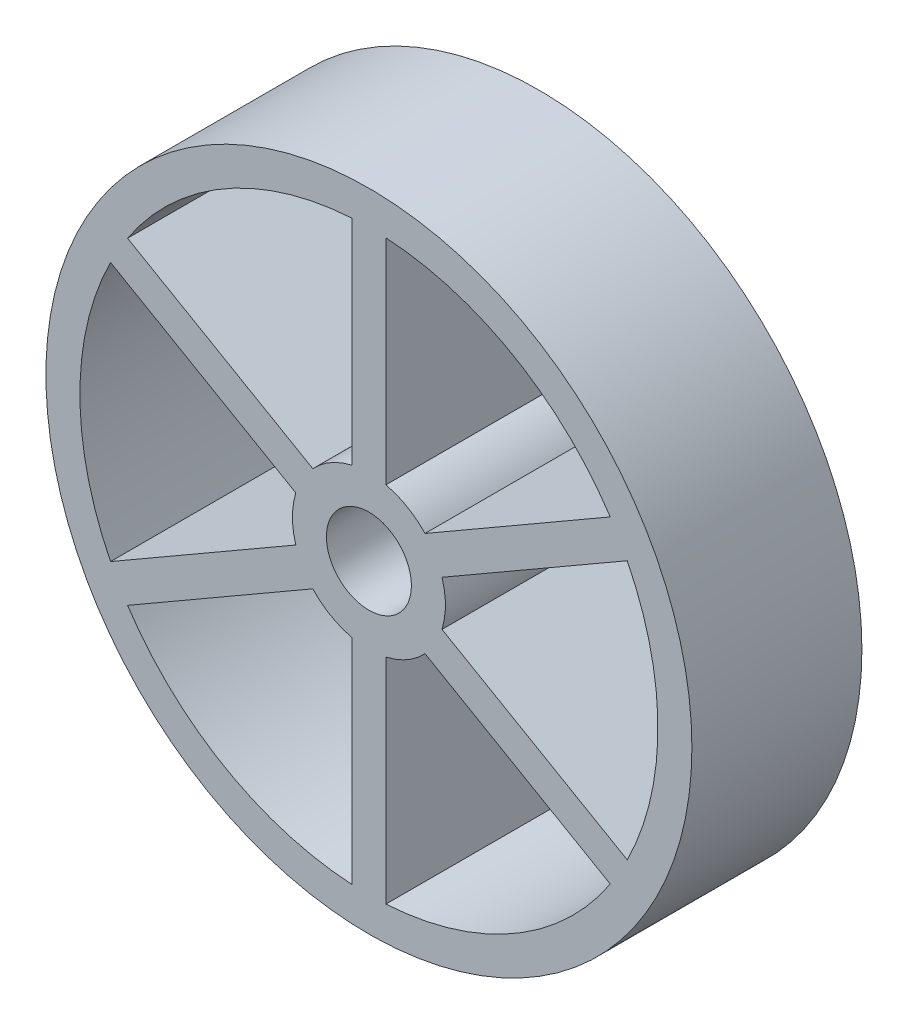
from build123d import *

# Parameters (mm, degrees)
SKETCH1_R           = 19
BOSS_EXTRUDE1_DEPTH = 10
SKETCH2_R           = 2.5
CUT_EXTRUDE1_DEPTH  = 10
CUT_EXTRUDE2_DEPTH  = 10


with BuildPart() as part:
    # Sketch1 → Boss-Extrude1 (new body)
    with BuildSketch(Plane.XY):
        Circle(SKETCH1_R)
    extrude(amount=BOSS_EXTRUDE1_DEPTH)

    # Sketch2 → Cut-Extrude1 (cut)
    with BuildSketch(Plane.XY.offset(10)):
        Circle(SKETCH2_R)
    extrude(amount=-CUT_EXTRUDE1_DEPTH, mode=Mode.SUBTRACT)

    # Sketch3 → Cut-Extrude2 (cut)
    with BuildSketch(Plane.XY.offset(10)):
        with BuildLine():
            ThreePointArc((-3.299671038, 3.059766501), (-2.25, 3.897114317), (-1, 4.387482194))
            Line((-1, 4.387482194), (-1, 16.970562748))
            ThreePointArc((-1, 16.970562748), (-8.5, 14.722431864), (-14.196938457, 9.351306778))
            Line((-14.196938457, 9.351306778), (-3.299671038, 3.059766501))
        make_face()
        with BuildLine():
            ThreePointArc((-4.299671038, -1.327715693), (-4.5, 0), (-4.299671038, 1.327715693))
            Line((-4.299671038, 1.327715693), (-15.196938457, 7.61925597))
            ThreePointArc((-15.196938457, 7.61925597), (-17, 0), (-15.196938457, -7.61925597))
            Line((-15.196938457, -7.61925597), (-4.299671038, -1.327715693))
        make_face()
        with BuildLine():
            ThreePointArc((-1, -4.387482194), (-2.25, -3.897114317), (-3.299671038, -3.059766501))
            Line((-3.299671038, -3.059766501), (-14.196938457, -9.351306778))
            ThreePointArc((-14.196938457, -9.351306778), (-8.5, -14.722431864), (-1, -16.970562748))
            Line((-1, -16.970562748), (-1, -4.387482194))
        make_face()
        with BuildLine():
            Line((14.196938457, -9.351306778), (3.299671038, -3.059766501))
            ThreePointArc((3.299671038, -3.059766501), (2.25, -3.897114317), (1, -4.387482194))
            Line((1, -4.387482194), (1, -16.970562748))
            ThreePointArc((1, -16.970562748), (8.5, -14.722431864), (14.196938457, -9.351306778))
        make_face()
        with BuildLine():
            Line((15.196938457, 7.61925597), (4.299671038, 1.327715693))
            ThreePointArc((4.299671038, 1.327715693), (4.449635922, 0.671371852), (4.5, 0))
            ThreePointArc((4.5, 0), (4.449635922, -0.671371852), (4.299671038, -1.327715693))
            Line((4.299671038, -1.327715693), (15.196938457, -7.61925597))
            ThreePointArc((15.196938457, -7.61925597), (16.543094538, -3.9148465), (17, 0))
            ThreePointArc((17, 0), (16.543094538, 3.9148465), (15.196938457, 7.61925597))
        make_face()
        with BuildLine():
            Line((1, 16.970562748), (1, 4.387482194))
            ThreePointArc((1, 4.387482194), (2.25, 3.897114317), (3.299671038, 3.059766501))
            Line((3.299671038, 3.059766501), (14.196938457, 9.351306778))
            ThreePointArc((14.196938457, 9.351306778), (8.5, 14.722431864), (1, 16.970562748))
        make_face()
    extrude(amount=-CUT_EXTRUDE2_DEPTH, mode=Mode.SUBTRACT)


solid = part.part
